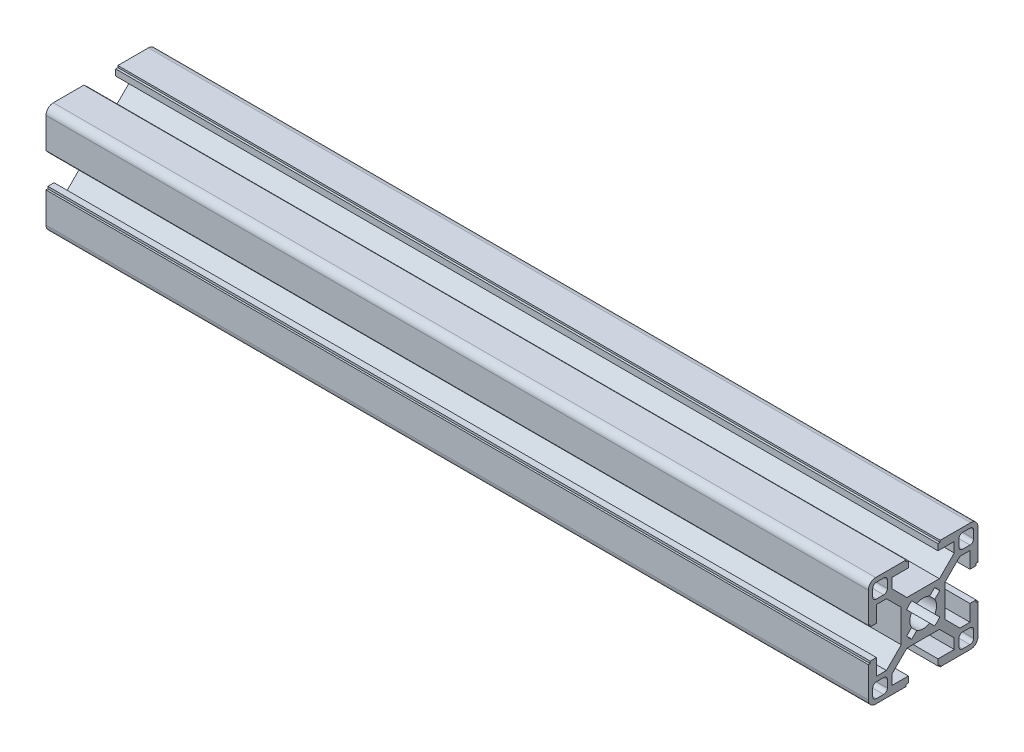
from build123d import *

# Parameters (mm, degrees)
AUFSATZ_LINEAR_AUSTRAGEN1_DEPTH = 300
SCALE1_SCALE_X                  = 1
SCALE1_SCALE_Y                  = 1.333333333
SCALE1_SCALE_Z                  = 1.333333333


with BuildPart() as part:
    # Skizze1 → Aufsatz-Linear austragen1 (new body)
    with BuildSketch(Plane(origin=(0, 0, 0), x_dir=(0, 0, -1), z_dir=(1, 0, 0))):
        with BuildLine():
            Line((10.055634919, 8.5), (12.8, 8.5))
            Line((12.8, 8.5), (12.8, 4.05))
            Line((12.8, 4.05), (14.5, 4.05))
            Line((14.5, 4.05), (14.5, 4.651637069))
            Line((14.5, 4.651637069), (15, 4.651637069))
            Line((15, 4.651637069), (15, 13))
            ThreePointArc((15, 13), (14.414213562, 14.414213562), (13, 15))
            Line((13, 15), (4.651637069, 15))
            Line((4.651637069, 15), (4.651637069, 14.5))
            Line((4.651637069, 14.5), (4.05, 14.5))
            Line((4.05, 14.5), (4.05, 12.8))
            Line((4.05, 12.8), (8.5, 12.8))
            Line((8.5, 12.8), (8.5, 10.055634919))
            Line((8.5, 10.055634919), (4.444365081, 6))
            Line((4.444365081, 6), (-4.444365081, 6))
            Line((-4.444365081, 6), (-8.5, 10.055634919))
            Line((-8.5, 10.055634919), (-8.5, 12.8))
            Line((-8.5, 12.8), (-4.05, 12.8))
            Line((-4.05, 12.8), (-4.05, 14.5))
            Line((-4.05, 14.5), (-4.651637069, 14.5))
            Line((-4.651637069, 14.5), (-4.651637069, 15))
            Line((-4.651637069, 15), (-13, 15))
            ThreePointArc((-13, 15), (-14.414213562, 14.414213562), (-15, 13))
            Line((-15, 13), (-15, 4.651637069))
            Line((-15, 4.651637069), (-14.5, 4.651637069))
            Line((-14.5, 4.651637069), (-14.5, 4.05))
            Line((-14.5, 4.05), (-12.8, 4.05))
            Line((-12.8, 4.05), (-12.8, 8.5))
            Line((-12.8, 8.5), (-10.055634919, 8.5))
            Line((-10.055634919, 8.5), (-6, 4.444365081))
            Line((-6, 4.444365081), (-6, -4.444365081))
            Line((-6, -4.444365081), (-10.055634919, -8.5))
            Line((-10.055634919, -8.5), (-12.8, -8.5))
            Line((-12.8, -8.5), (-12.8, -4.05))
            Line((-12.8, -4.05), (-14.5, -4.05))
            Line((-14.5, -4.05), (-14.5, -4.651637069))
            Line((-14.5, -4.651637069), (-15, -4.651637069))
            Line((-15, -4.651637069), (-15, -13))
            ThreePointArc((-15, -13), (-14.414213562, -14.414213562), (-13, -15))
            Line((-13, -15), (-4.651637069, -15))
            Line((-4.651637069, -15), (-4.651637069, -14.5))
            Line((-4.651637069, -14.5), (-4.05, -14.5))
            Line((-4.05, -14.5), (-4.05, -12.8))
            Line((-4.05, -12.8), (-8.5, -12.8))
            Line((-8.5, -12.8), (-8.5, -10.055634919))
            Line((-8.5, -10.055634919), (-4.444365081, -6))
            Line((-4.444365081, -6), (4.444365081, -6))
            Line((4.444365081, -6), (8.5, -10.055634919))
            Line((8.5, -10.055634919), (8.5, -12.8))
            Line((8.5, -12.8), (4.05, -12.8))
            Line((4.05, -12.8), (4.05, -14.5))
            Line((4.05, -14.5), (4.651637069, -14.5))
            Line((4.651637069, -14.5), (4.651637069, -15))
            Line((4.651637069, -15), (13, -15))
            ThreePointArc((13, -15), (14.414213562, -14.414213562), (15, -13))
            Line((15, -13), (15, -4.651637069))
            Line((15, -4.651637069), (14.5, -4.651637069))
            Line((14.5, -4.651637069), (14.5, -4.05))
            Line((14.5, -4.05), (12.8, -4.05))
            Line((12.8, -4.05), (12.8, -8.5))
            Line((12.8, -8.5), (10.055634919, -8.5))
            Line((10.055634919, -8.5), (6, -4.444365081))
            Line((6, -4.444365081), (6, 4.444365081))
            Line((6, 4.444365081), (10.055634919, 8.5))
        make_face()
        with BuildLine():
            ThreePointArc((12.8, 13.8), (13.507106781, 13.507106781), (13.8, 12.8))
            Line((13.8, 12.8), (13.8, 10.8))
            ThreePointArc((13.8, 10.8), (13.507106781, 10.092893219), (12.8, 9.8))
            Line((12.8, 9.8), (10.8, 9.8))
            ThreePointArc((10.8, 9.8), (10.092893219, 10.092893219), (9.8, 10.8))
            Line((9.8, 10.8), (9.8, 12.8))
            ThreePointArc((9.8, 12.8), (10.092893219, 13.507106781), (10.8, 13.8))
            Line((10.8, 13.8), (12.8, 13.8))
        make_face(mode=Mode.SUBTRACT)
        with BuildLine():
            Line((-3.117157854, 4.531371416), (-1.775079755, 3.189293317))
            ThreePointArc((-1.775079755, 3.189293317), (0, 3.65), (1.775079755, 3.189293317))
            Line((1.775079755, 3.189293317), (3.117157854, 4.531371416))
            ThreePointArc((3.117157854, 4.531371416), (3.889087297, 3.889087297), (4.531371416, 3.117157854))
            Line((4.531371416, 3.117157854), (3.189293317, 1.775079755))
            ThreePointArc((3.189293317, 1.775079755), (3.65, 0), (3.189293317, -1.775079755))
            Line((3.189293317, -1.775079755), (4.531371416, -3.117157854))
            ThreePointArc((4.531371416, -3.117157854), (3.889087297, -3.889087297), (3.117157854, -4.531371416))
            Line((3.117157854, -4.531371416), (1.775079755, -3.189293317))
            ThreePointArc((1.775079755, -3.189293317), (0, -3.65), (-1.775079755, -3.189293317))
            Line((-1.775079755, -3.189293317), (-3.117157854, -4.531371416))
            ThreePointArc((-3.117157854, -4.531371416), (-3.889087297, -3.889087297), (-4.531371416, -3.117157854))
            Line((-4.531371416, -3.117157854), (-3.189293317, -1.775079755))
            ThreePointArc((-3.189293317, -1.775079755), (-3.65, 0), (-3.189293317, 1.775079755))
            Line((-3.189293317, 1.775079755), (-4.531371416, 3.117157854))
            ThreePointArc((-4.531371416, 3.117157854), (-3.889087297, 3.889087297), (-3.117157854, 4.531371416))
        make_face(mode=Mode.SUBTRACT)
        with BuildLine():
            ThreePointArc((-13.8, 12.8), (-13.507106781, 13.507106781), (-12.8, 13.8))
            Line((-12.8, 13.8), (-10.8, 13.8))
            ThreePointArc((-10.8, 13.8), (-10.092893219, 13.507106781), (-9.8, 12.8))
            Line((-9.8, 12.8), (-9.8, 10.8))
            ThreePointArc((-9.8, 10.8), (-10.092893219, 10.092893219), (-10.8, 9.8))
            Line((-10.8, 9.8), (-12.8, 9.8))
            ThreePointArc((-12.8, 9.8), (-13.507106781, 10.092893219), (-13.8, 10.8))
            Line((-13.8, 10.8), (-13.8, 12.8))
        make_face(mode=Mode.SUBTRACT)
        with BuildLine():
            ThreePointArc((9.8, -10.8), (10.092893219, -10.092893219), (10.8, -9.8))
            Line((10.8, -9.8), (12.8, -9.8))
            ThreePointArc((12.8, -9.8), (13.507106781, -10.092893219), (13.8, -10.8))
            Line((13.8, -10.8), (13.8, -12.8))
            ThreePointArc((13.8, -12.8), (13.507106781, -13.507106781), (12.8, -13.8))
            Line((12.8, -13.8), (10.8, -13.8))
            ThreePointArc((10.8, -13.8), (10.092893219, -13.507106781), (9.8, -12.8))
            Line((9.8, -12.8), (9.8, -10.8))
        make_face(mode=Mode.SUBTRACT)
        with BuildLine():
            Line((-9.8, -10.8), (-9.8, -12.8))
            ThreePointArc((-9.8, -12.8), (-10.092893219, -13.507106781), (-10.8, -13.8))
            Line((-10.8, -13.8), (-12.8, -13.8))
            ThreePointArc((-12.8, -13.8), (-13.507106781, -13.507106781), (-13.8, -12.8))
            Line((-13.8, -12.8), (-13.8, -10.8))
            ThreePointArc((-13.8, -10.8), (-13.507106781, -10.092893219), (-12.8, -9.8))
            Line((-12.8, -9.8), (-10.8, -9.8))
            ThreePointArc((-10.8, -9.8), (-10.092893219, -10.092893219), (-9.8, -10.8))
        make_face(mode=Mode.SUBTRACT)
    extrude(amount=AUFSATZ_LINEAR_AUSTRAGEN1_DEPTH)


with BuildPart() as part_1:
    # Scale1: scaled about (150, 0, 0)
    add(part.part.scale((SCALE1_SCALE_X, SCALE1_SCALE_Y, SCALE1_SCALE_Z), about=(150, 0, 0)))


solid = part_1.part
